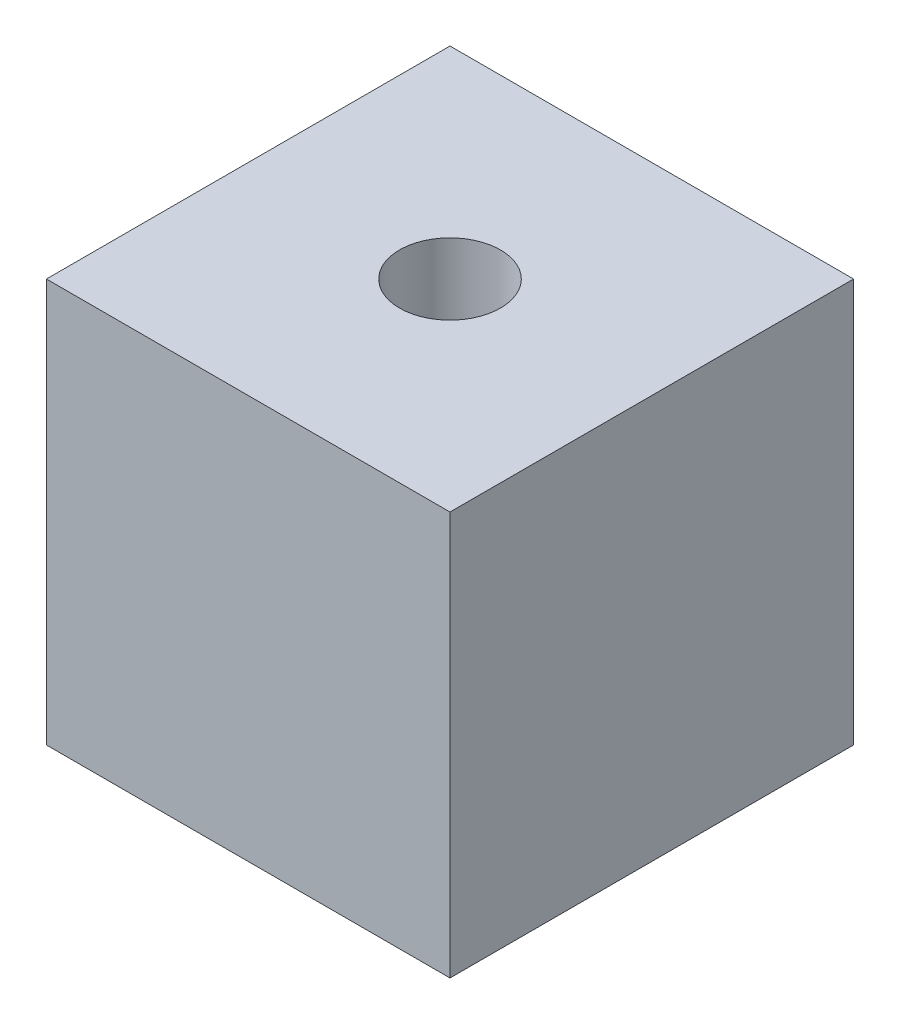
from build123d import *

# Parameters (mm, degrees)
SKETCH1_W           = 25.4
SKETCH1_H           = 25.4
SKETCH1_R           = 3.175
BOSS_EXTRUDE1_DEPTH = 25.4


with BuildPart() as part:
    # Sketch1 → Boss-Extrude1 (new body)
    with BuildSketch(Plane(origin=(0, 0, 0), x_dir=(1, 0, 0), z_dir=(0, 1, 0))):
        with Locations((12.7, 12.7)):
            Rectangle(SKETCH1_W, SKETCH1_H)
        with Locations(Location((12.7, 12.7, 0), (0, 0, 270))):
            Circle(SKETCH1_R, mode=Mode.SUBTRACT)
    extrude(amount=BOSS_EXTRUDE1_DEPTH)


solid = part.part
